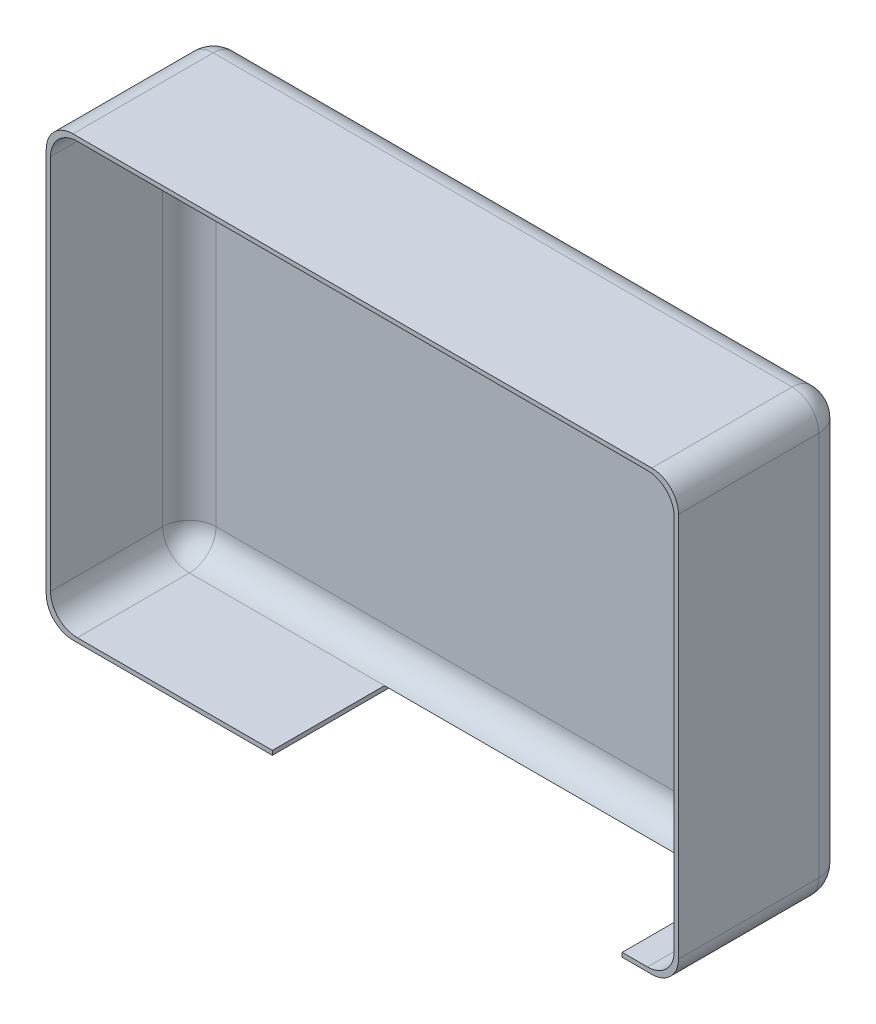
from build123d import *

# Parameters (mm, degrees)
BOSS_EXTRUDE1_DEPTH = 88.9
CUT_EXTRUDE1_DEPTH  = 73.914
FILLET1_R           = 14.224
FILLET2_R           = 14.224
CUT_EXTRUDE2_DEPTH  = 2.286


with BuildPart() as part:
    # Sketch1 → Boss-Extrude1 (new body)
    with BuildSketch(Plane.XY):
        with BuildLine():
            Line((-41.405944168, 22.056216238), (266.696055832, 22.056216238))
            ThreePointArc((266.696055832, 22.056216238), (276.753942688, 17.890103094), (280.920055832, 7.832216238))
            Line((280.920055832, 7.832216238), (280.920055832, -197.145783762))
            ThreePointArc((280.920055832, -197.145783762), (276.753942688, -207.203670617), (266.696055832, -211.369783762))
            Line((266.696055832, -211.369783762), (-41.405944168, -211.369783762))
            ThreePointArc((-41.405944168, -211.369783762), (-51.463831024, -207.203670617), (-55.629944168, -197.145783762))
            Line((-55.629944168, -197.145783762), (-55.629944168, 7.832216238))
            ThreePointArc((-55.629944168, 7.832216238), (-51.463831024, 17.890103094), (-41.405944168, 22.056216238))
        make_face()
    extrude(amount=BOSS_EXTRUDE1_DEPTH)

    # Sketch4 → Cut-Extrude1 (cut)
    with BuildSketch(Plane.XY.offset(88.9)):
        with BuildLine():
            Line((-39.119944168, -209.083783762), (264.410055832, -209.083783762))
            ThreePointArc((264.410055832, -209.083783762), (274.467942688, -204.917670617), (278.634055832, -194.859783762))
            Line((278.634055832, -194.859783762), (278.634055832, 5.546216238))
            ThreePointArc((278.634055832, 5.546216238), (274.467942688, 15.604103094), (264.410055832, 19.770216238))
            Line((264.410055832, 19.770216238), (-39.119944168, 19.770216238))
            ThreePointArc((-39.119944168, 19.770216238), (-49.177831024, 15.604103094), (-53.343944168, 5.546216238))
            Line((-53.343944168, 5.546216238), (-53.343944168, -194.859783762))
            ThreePointArc((-53.343944168, -194.859783762), (-49.177831024, -204.917670617), (-39.119944168, -209.083783762))
        make_face()
    extrude(amount=-CUT_EXTRUDE1_DEPTH, mode=Mode.SUBTRACT)

    # Fillet1
    fillet1_edges = [part.edges().sort_by_distance(p)[0] for p in [
        (-49.177831024, -204.917670617, 14.986),
        (-53.343944168, -94.656783762, 14.986),
        (-49.177831024, 15.604103094, 14.986),
        (112.645055832, 19.770216238, 14.986),
        (274.467942688, 15.604103094, 14.986),
        (278.634055832, -94.656783762, 14.986),
        (274.467942688, -204.917670617, 14.986),
        (112.645055832, -209.083783762, 14.986),
    ]]
    fillet(fillet1_edges, radius=FILLET1_R)

    # Fillet2
    fillet2_edges = [part.edges().sort_by_distance(p)[0] for p in [
        (-55.629944168, -94.656783762, 0),
        (-51.463831024, 17.890103094, 0),
        (112.645055832, 22.056216238, 0),
        (276.753942688, 17.890103094, 0),
        (280.920055832, -94.656783762, 0),
        (276.753942688, -207.203670617, 0),
        (112.645055832, -211.369783762, 0),
        (-51.463831024, -207.203670617, 0),
    ]]
    fillet(fillet2_edges, radius=FILLET2_R)

    # Sketch5 → Cut-Extrude2 (cut)
    with BuildSketch(Plane(origin=(0, -211.369783762, 0), x_dir=(-1, 0, 0), z_dir=(0, -1, 0))):
        with BuildLine():
            Line((-69.838151491, -14.224), (-245.885767903, -14.224))
            ThreePointArc((-245.885767903, -14.224), (-249.477870351, -15.711897552), (-250.965767903, -19.304))
            Line((-250.965767903, -19.304), (-250.965767903, -88.9))
            Line((-250.965767903, -88.9), (-64.758151491, -88.9))
            Line((-64.758151491, -88.9), (-64.758151491, -19.304))
            ThreePointArc((-64.758151491, -19.304), (-66.246049042, -15.711897552), (-69.838151491, -14.224))
        make_face()
    extrude(amount=-CUT_EXTRUDE2_DEPTH, mode=Mode.SUBTRACT)


solid = part.part
